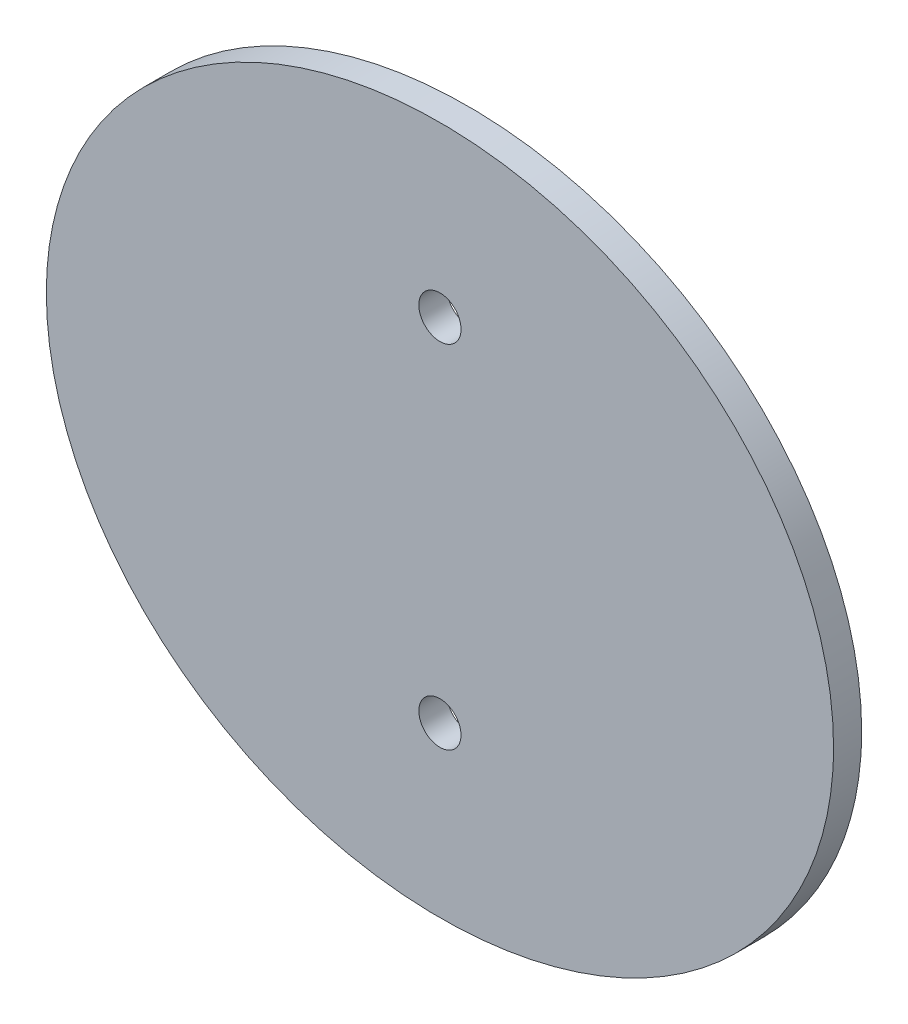
from build123d import *

# Parameters (mm, degrees)
SKETCH1_RX          = 28
SKETCH1_RY          = 24.5
SKETCH1_R           = 1.5
BOSS_EXTRUDE1_DEPTH = 2


with BuildPart() as part:
    # Sketch1 → Boss-Extrude1 (new body)
    with BuildSketch(Plane.XY):
        with Locations((0, 0)):
            Ellipse(SKETCH1_RX, SKETCH1_RY)
        with Locations((0, 12.5)):
            Circle(SKETCH1_R, mode=Mode.SUBTRACT)
        with Locations((0, -12.5)):
            Circle(SKETCH1_R, mode=Mode.SUBTRACT)
    extrude(amount=BOSS_EXTRUDE1_DEPTH)


solid = part.part
